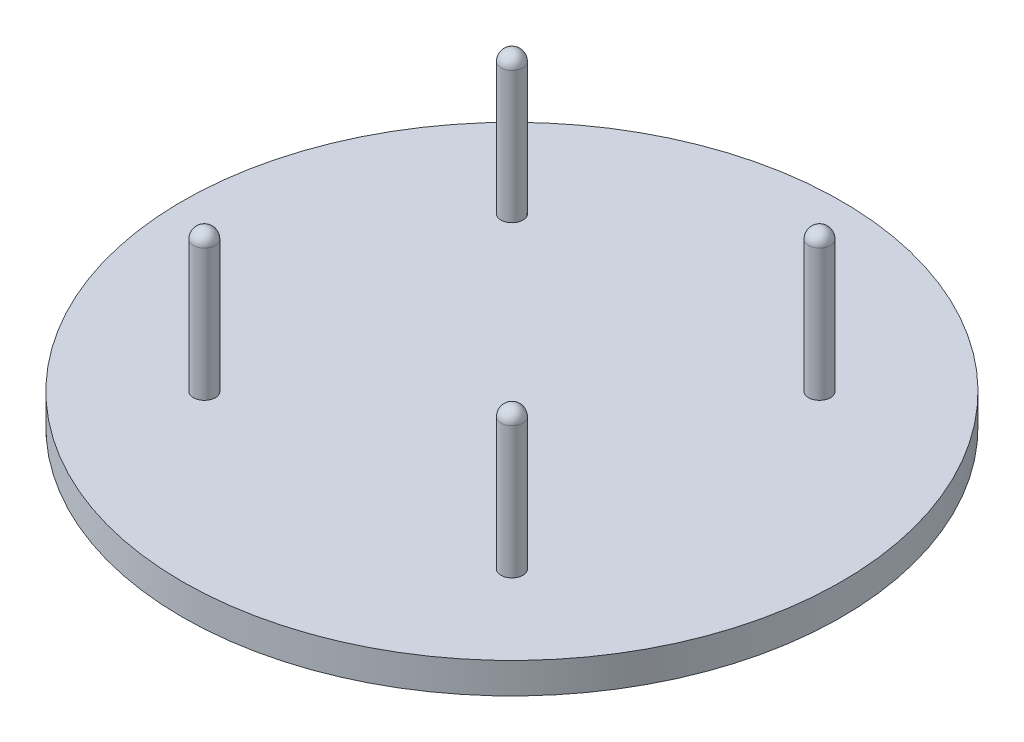
from build123d import *

# Parameters (mm, degrees)
SKETCH1_R                      = 75
BOSS_EXTRUDE1_DEPTH            = 7
SKETCH2_R                      = 2.5
BOSS_EXTRUDE2_DEPTH            = 30
DOME1_FACE_RADIUS              = 2.5
DOME1_HEIGHT                   = 2.5
CIRPATTERN1_COUNT              = 4
CIRPATTERN1_COPY_1_FACE_RADIUS = 2.5
CIRPATTERN1_COPY_1_HEIGHT      = 2.5
CIRPATTERN1_COPY_2_FACE_RADIUS = 2.5
CIRPATTERN1_COPY_2_HEIGHT      = 2.5
CIRPATTERN1_COPY_3_FACE_RADIUS = 2.5
CIRPATTERN1_COPY_3_HEIGHT      = 2.5


with BuildPart() as part:
    # Sketch1 → Boss-Extrude1 (new body)
    with BuildSketch(Plane(origin=(0, 0, 0), x_dir=(1, 0, 0), z_dir=(0, 1, 0))):
        with Locations(Location((0, 0, 0), (0, 0, 270))):
            Circle(SKETCH1_R)
    extrude(amount=BOSS_EXTRUDE1_DEPTH)

    # Sketch2 → Boss-Extrude2 (add)
    with BuildSketch(Plane(origin=(0, 7, 0), x_dir=(1, 0, 0), z_dir=(0, 1, 0))):
        with Locations(Location((35, 35, 0), (0, 0, 270))):
            Circle(SKETCH2_R)
    boss_extrude2 = extrude(amount=BOSS_EXTRUDE2_DEPTH)

    # Dome1: a dome of height H over a round flat face of radius A is a cap of a sphere of radius (A * A + H * H) / (2 * H)
    dome1_r = (DOME1_FACE_RADIUS * DOME1_FACE_RADIUS + DOME1_HEIGHT * DOME1_HEIGHT) / (2 * DOME1_HEIGHT)
    dome1_base = Plane((35, 37, -35), z_dir=(0, 1, 0))
    with Locations(dome1_base.offset(DOME1_HEIGHT - dome1_r)):
        dome1_ball = Sphere(dome1_r, mode=Mode.PRIVATE)
    add(split(dome1_ball, bisect_by=dome1_base, keep=Keep.TOP, mode=Mode.PRIVATE))

    # CirPattern1: Boss-Extrude2 ×4 about axis
    cirpattern1_axis = Axis((0, 0, 0), (0, 1, 0))
    for i in range(1, CIRPATTERN1_COUNT):
        add(boss_extrude2.rotate(cirpattern1_axis, i * 360 / CIRPATTERN1_COUNT))

    # CirPattern1 copy 1: a dome of height H over a round flat face of radius A is a cap of a sphere of radius (A * A + H * H) / (2 * H)
    cirpattern1_copy_1_r = (CIRPATTERN1_COPY_1_FACE_RADIUS * CIRPATTERN1_COPY_1_FACE_RADIUS + CIRPATTERN1_COPY_1_HEIGHT * CIRPATTERN1_COPY_1_HEIGHT) / (2 * CIRPATTERN1_COPY_1_HEIGHT)
    cirpattern1_copy_1_base = Plane((-35, 37, -35), z_dir=(0, 1, 0))
    with Locations(cirpattern1_copy_1_base.offset(CIRPATTERN1_COPY_1_HEIGHT - cirpattern1_copy_1_r)):
        cirpattern1_copy_1_ball = Sphere(cirpattern1_copy_1_r, mode=Mode.PRIVATE)
    add(split(cirpattern1_copy_1_ball, bisect_by=cirpattern1_copy_1_base, keep=Keep.TOP, mode=Mode.PRIVATE))

    # CirPattern1 copy 2: a dome of height H over a round flat face of radius A is a cap of a sphere of radius (A * A + H * H) / (2 * H)
    cirpattern1_copy_2_r = (CIRPATTERN1_COPY_2_FACE_RADIUS * CIRPATTERN1_COPY_2_FACE_RADIUS + CIRPATTERN1_COPY_2_HEIGHT * CIRPATTERN1_COPY_2_HEIGHT) / (2 * CIRPATTERN1_COPY_2_HEIGHT)
    cirpattern1_copy_2_base = Plane((-35, 37, 35), z_dir=(0, 1, 0))
    with Locations(cirpattern1_copy_2_base.offset(CIRPATTERN1_COPY_2_HEIGHT - cirpattern1_copy_2_r)):
        cirpattern1_copy_2_ball = Sphere(cirpattern1_copy_2_r, mode=Mode.PRIVATE)
    add(split(cirpattern1_copy_2_ball, bisect_by=cirpattern1_copy_2_base, keep=Keep.TOP, mode=Mode.PRIVATE))

    # CirPattern1 copy 3: a dome of height H over a round flat face of radius A is a cap of a sphere of radius (A * A + H * H) / (2 * H)
    cirpattern1_copy_3_r = (CIRPATTERN1_COPY_3_FACE_RADIUS * CIRPATTERN1_COPY_3_FACE_RADIUS + CIRPATTERN1_COPY_3_HEIGHT * CIRPATTERN1_COPY_3_HEIGHT) / (2 * CIRPATTERN1_COPY_3_HEIGHT)
    cirpattern1_copy_3_base = Plane((35, 37, 35), z_dir=(0, 1, 0))
    with Locations(cirpattern1_copy_3_base.offset(CIRPATTERN1_COPY_3_HEIGHT - cirpattern1_copy_3_r)):
        cirpattern1_copy_3_ball = Sphere(cirpattern1_copy_3_r, mode=Mode.PRIVATE)
    add(split(cirpattern1_copy_3_ball, bisect_by=cirpattern1_copy_3_base, keep=Keep.TOP, mode=Mode.PRIVATE))


solid = part.part
